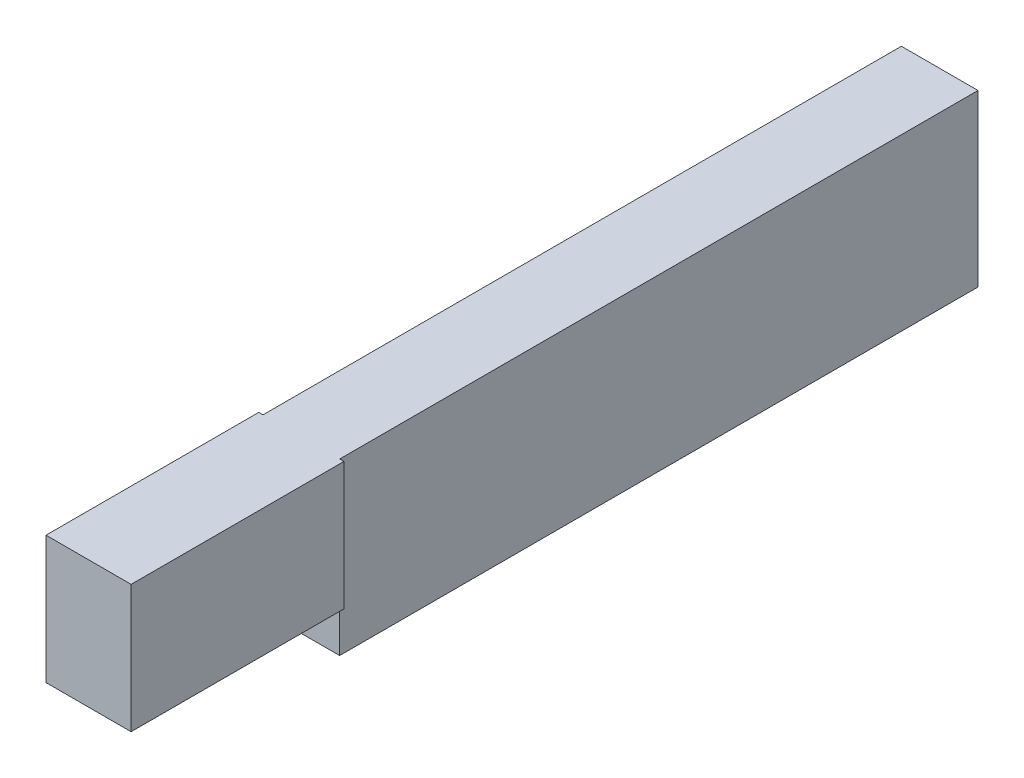
from build123d import *

# Parameters (mm, degrees)
SKETCH2_W           = 5
SKETCH2_H           = 7.5
BOSS_EXTRUDE2_DEPTH = 12.5
SKETCH1_W           = 4.5
SKETCH1_H           = 10
BOSS_EXTRUDE4_DEPTH = 37.5


with BuildPart() as part:
    # Sketch2 → Boss-Extrude2 (new body)
    with BuildSketch(Plane.XY.offset(37.5)):
        with Locations((0, 1.25)):
            Rectangle(SKETCH2_W, SKETCH2_H)
    extrude(amount=BOSS_EXTRUDE2_DEPTH)

    # Sketch1 → Boss-Extrude4 (add)
    with BuildSketch(Plane.XY):
        Rectangle(SKETCH1_W, SKETCH1_H)
    extrude(amount=BOSS_EXTRUDE4_DEPTH)


solid = part.part
